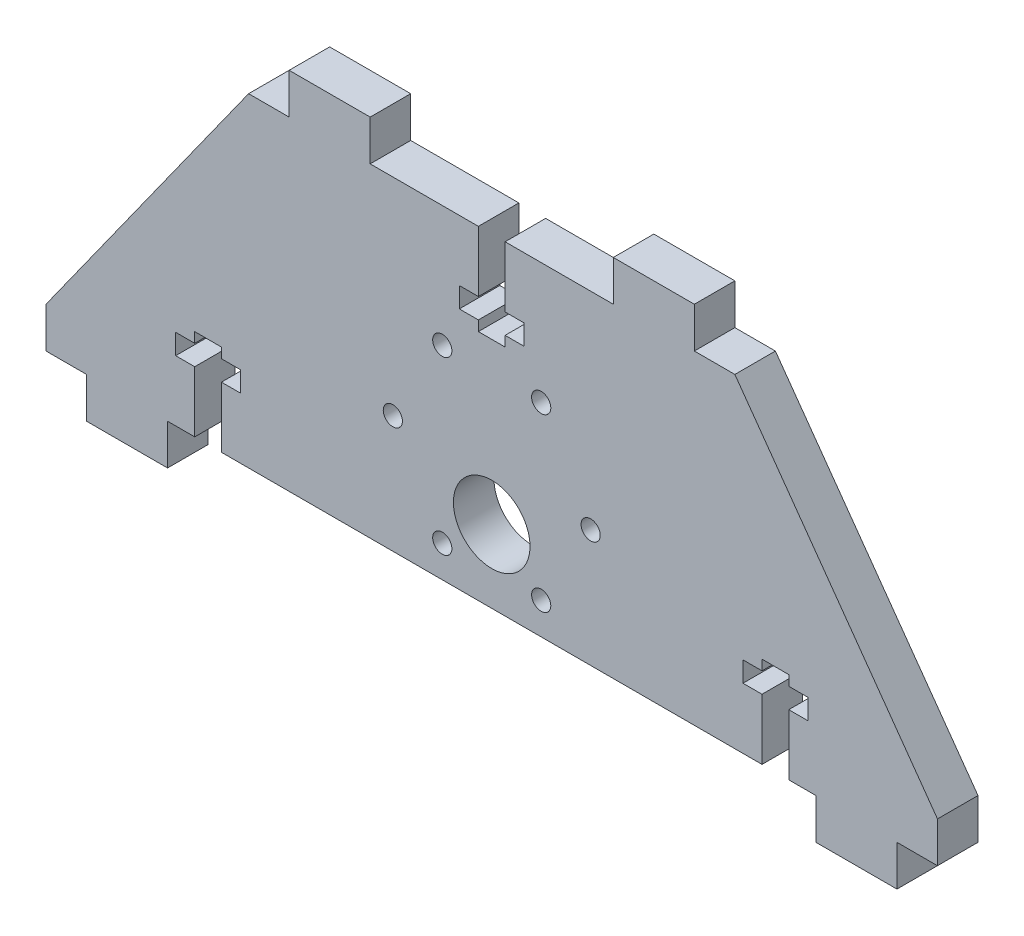
from build123d import *

# Parameters (mm, degrees)
SKETCH1_W           = 139.7
SKETCH1_H           = 50.8
BOSS_EXTRUDE1_DEPTH = 6.35
SKETCH2_W           = 12.7
SKETCH2_H           = 6.35
BOSS_EXTRUDE2_DEPTH = 6.35
CUT_EXTRUDE1_DEPTH  = 6.35
CUT_EXTRUDE8_DEPTH  = 6.35
CUT_EXTRUDE2_DEPTH  = 6.35
SKETCH5_R           = 1.504
CUT_EXTRUDE6_DEPTH  = 6.35
SKETCH6_R           = 6
CUT_EXTRUDE7_DEPTH  = 6.35


with BuildPart() as part:
    # Sketch1 → Boss-Extrude1 (new body)
    with BuildSketch(Plane.XY):
        Rectangle(SKETCH1_W, SKETCH1_H)
    extrude(amount=BOSS_EXTRUDE1_DEPTH)

    # Sketch2 → Boss-Extrude2 (add)
    with BuildSketch(Plane(origin=(0, 0, 0), x_dir=(-1, 0, 0), z_dir=(0, 0, -1))):
        with Locations((-57.15, -28.575)):
            Rectangle(SKETCH2_W, SKETCH2_H)
        with Locations((-25.4, 28.575)):
            Rectangle(SKETCH2_W, SKETCH2_H)
    boss_extrude2 = extrude(amount=-BOSS_EXTRUDE2_DEPTH)

    # Sketch3 → Cut-Extrude1 (cut)
    with BuildSketch(Plane(origin=(0, 0, 0), x_dir=(-1, 0, 0), z_dir=(0, 0, -1))):
        Polygon((-46.5455, -25.4), (-46.5455, -15.875), (-49.53, -15.875), (-49.53, -12.7), (-46.5455, -12.7), (-46.5455, -11.1125), (-42.3545, -11.1125), (-42.3545, -12.7), (-39.37, -12.7), (-39.37, -15.875), (-42.3545, -15.875), (-42.3545, -25.4), align=None)
    cut_extrude1 = extrude(amount=-CUT_EXTRUDE1_DEPTH, mode=Mode.SUBTRACT)

    # Sketch7 → Cut-Extrude8 (cut)
    with BuildSketch(Plane(origin=(0, 0, 0), x_dir=(-1, 0, 0), z_dir=(0, 0, -1))):
        Polygon((-38.1, 25.4), (-69.85, -19.05), (-69.85, 25.4), align=None)
    cut_extrude8 = extrude(amount=-CUT_EXTRUDE8_DEPTH, mode=Mode.SUBTRACT)

    # Mirror2: Boss-Extrude2, Cut-Extrude8 across plane
    add(boss_extrude2.mirror(Plane(origin=(0, 0, 0), x_dir=(0, 0, 1), z_dir=(1, 0, 0))))
    add(cut_extrude8.mirror(Plane(origin=(0, 0, 0), x_dir=(0, 0, 1), z_dir=(1, 0, 0))), mode=Mode.SUBTRACT)

    # Mirror4: Cut-Extrude1 across plane
    add(cut_extrude1.mirror(Plane(origin=(0, 0, 0), x_dir=(0, 0, 1), z_dir=(1, 0, 0))), mode=Mode.SUBTRACT)

    # Sketch4 → Cut-Extrude2 (cut)
    with BuildSketch(Plane(origin=(0, 0, 0), x_dir=(-1, 0, 0), z_dir=(0, 0, -1))):
        Polygon((2.0955, 25.4), (-2.0955, 25.4), (-2.0955, 15.875), (-5.08, 15.875), (-5.08, 12.7), (-2.0955, 12.7), (-2.0955, 11.1125), (2.0955, 11.1125), (2.0955, 12.7), (5.08, 12.7), (5.08, 15.875), (2.0955, 15.875), align=None)
    extrude(amount=-CUT_EXTRUDE2_DEPTH, mode=Mode.SUBTRACT)

    # Sketch5 → Cut-Extrude6 (cut)
    with BuildSketch(Plane(origin=(0, 0, 0), x_dir=(-1, 0, 0), z_dir=(0, 0, -1))):
        with Locations((-7.75, 6.423393759)):
            Circle(SKETCH5_R)
        with Locations((-15.5, -7)):
            Circle(SKETCH5_R)
        with Locations((-7.75, -20.423393759)):
            Circle(SKETCH5_R)
        with Locations((7.75, -20.423393759)):
            Circle(SKETCH5_R)
        with Locations((15.5, -7)):
            Circle(SKETCH5_R)
        with Locations((7.75, 6.423393759)):
            Circle(SKETCH5_R)
    extrude(amount=-CUT_EXTRUDE6_DEPTH, mode=Mode.SUBTRACT)

    # Sketch6 → Cut-Extrude7 (cut)
    with BuildSketch(Plane(origin=(0, 0, 0), x_dir=(-1, 0, 0), z_dir=(0, 0, -1))):
        with Locations((0, -14)):
            Circle(SKETCH6_R)
    extrude(amount=-CUT_EXTRUDE7_DEPTH, mode=Mode.SUBTRACT)


solid = part.part
